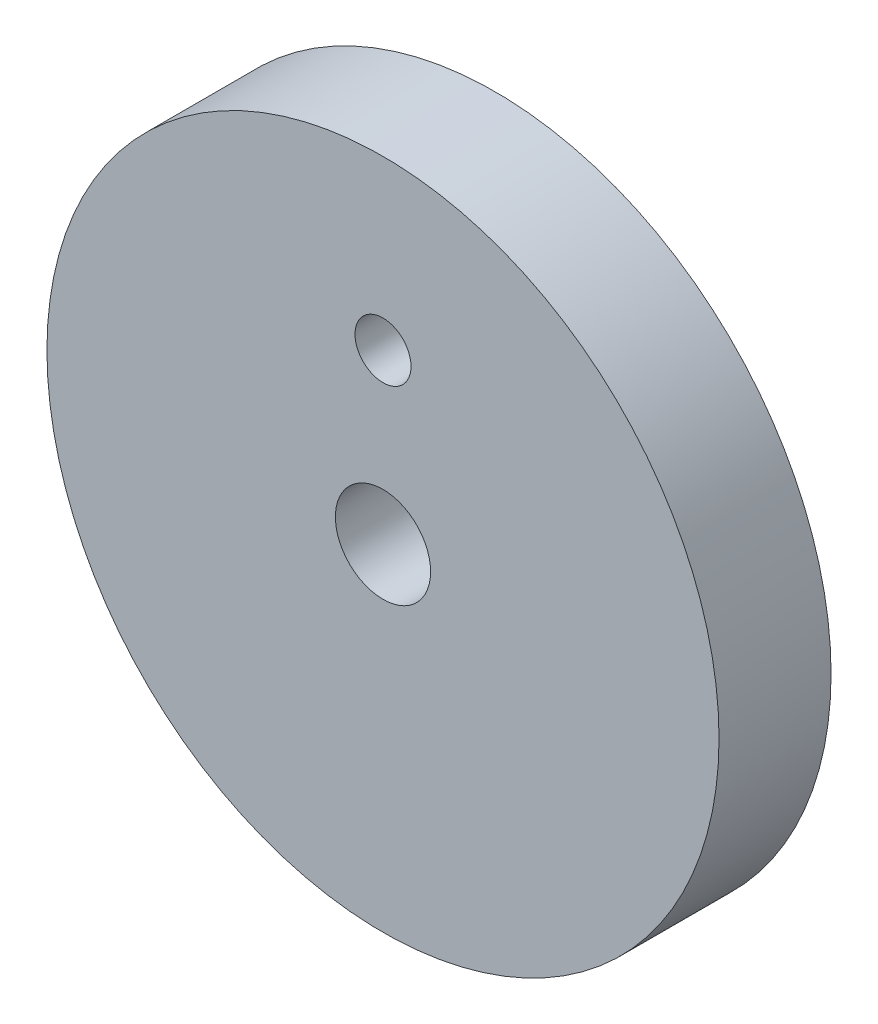
from build123d import *

# Parameters (mm, degrees)
SKETCH1_R               = 30
BOSS_EXTRUDE1_DEPTH     = 10
SKETCH2_R               = 2.5
CUT_EXTRUDE1_DEPTH      = 10
CUT_EXTRUDE4_DEPTH      = 10
CUT_EXTRUDE4_DEPTH_BACK = 10
SKETCH4_R               = 4.25


with BuildPart() as part:
    # Sketch1 → Boss-Extrude1 (new body)
    with BuildSketch(Plane.XY):
        Circle(SKETCH1_R)
    extrude(amount=BOSS_EXTRUDE1_DEPTH)

    # Sketch2 → Cut-Extrude1 (cut)
    with BuildSketch(Plane.XY):
        with Locations((0, 15)):
            Circle(SKETCH2_R)
    extrude(amount=CUT_EXTRUDE1_DEPTH, mode=Mode.SUBTRACT)

    # Sketch4 → Cut-Extrude4 (cut, two sides: drawn at the far end of the back side and taken through both)
    with BuildSketch(Plane.XY.offset(-CUT_EXTRUDE4_DEPTH_BACK)):
        Circle(SKETCH4_R)
    extrude(amount=CUT_EXTRUDE4_DEPTH + CUT_EXTRUDE4_DEPTH_BACK, mode=Mode.SUBTRACT)


solid = part.part
